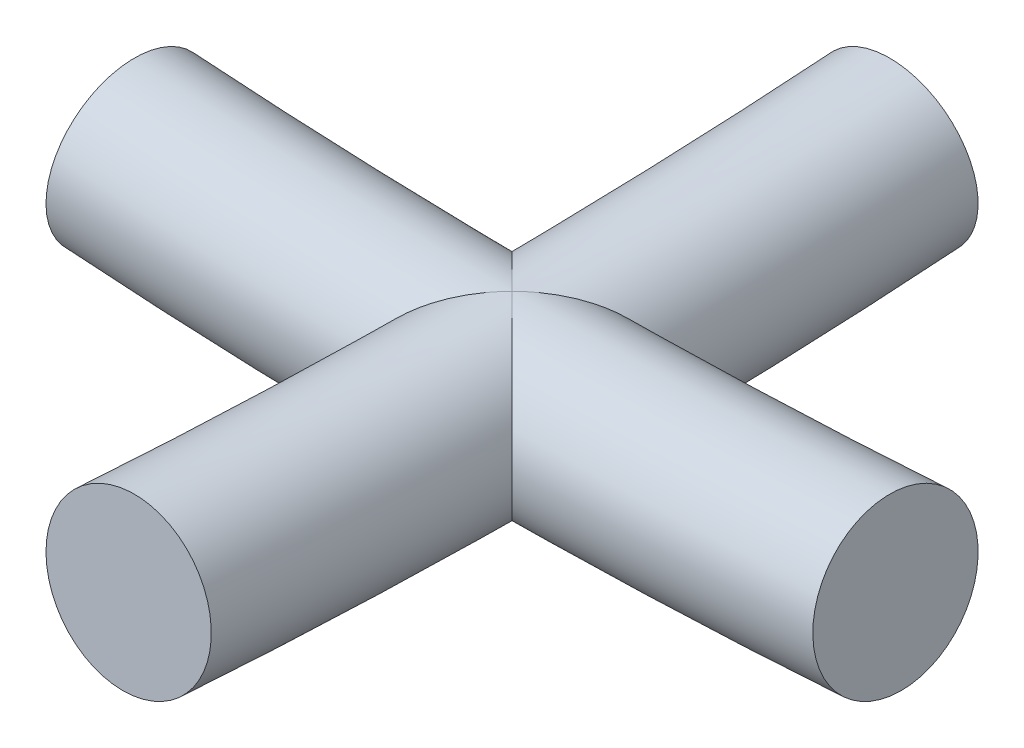
from build123d import *
from build123d.topology import SkipClean

# Parameters (mm, degrees)
SKETCH3_R                = 7.5
REVOLVE1_ANGLE           = 4
REVOLVE1_OTHER_WAY_ANGLE = 4
SKETCH4_R                = 7.5
REVOLVE2_ANGLE           = 4
REVOLVE2_OTHER_WAY_ANGLE = 4


with BuildPart() as part:
    # Sketch3 → Revolve1 (revolve)
    with BuildSketch(Plane.XY):
        with Locations((0, -500)):
            Circle(SKETCH3_R)
    revolve(axis=Axis((8.68934, 0, 0), (-1, 0, 0)), revolution_arc=REVOLVE1_ANGLE)

    # Sketch3 → Revolve1 other way (revolve)
    with SkipClean():  # the faces are left unmerged after this step: merging them gives an invalid solid
        with BuildSketch(Plane.XY):
            with Locations((0, -500)):
                Circle(SKETCH3_R)
        revolve(axis=Axis((8.68934, 0, 0), (1, 0, 0)), revolution_arc=REVOLVE1_OTHER_WAY_ANGLE)

    # Sketch4 → Revolve2 (revolve)
    with SkipClean():  # the faces are left unmerged after this step: merging them gives an invalid solid
        with BuildSketch(Plane(origin=(0, 0, 0), x_dir=(0, 0, -1), z_dir=(1, 0, 0))):
            with Locations((0, -500)):
                Circle(SKETCH4_R)
        revolve(axis=Axis((0, 0, -38.972198277), (0, 0, 1)), revolution_arc=REVOLVE2_ANGLE)

    # Sketch4 → Revolve2 other way (revolve)
    with BuildSketch(Plane(origin=(0, 0, 0), x_dir=(0, 0, -1), z_dir=(1, 0, 0))):
        with Locations((0, -500)):
            Circle(SKETCH4_R)
    revolve(axis=Axis((0, 0, -38.972198277), (0, 0, -1)), revolution_arc=REVOLVE2_OTHER_WAY_ANGLE)


solid = part.part
